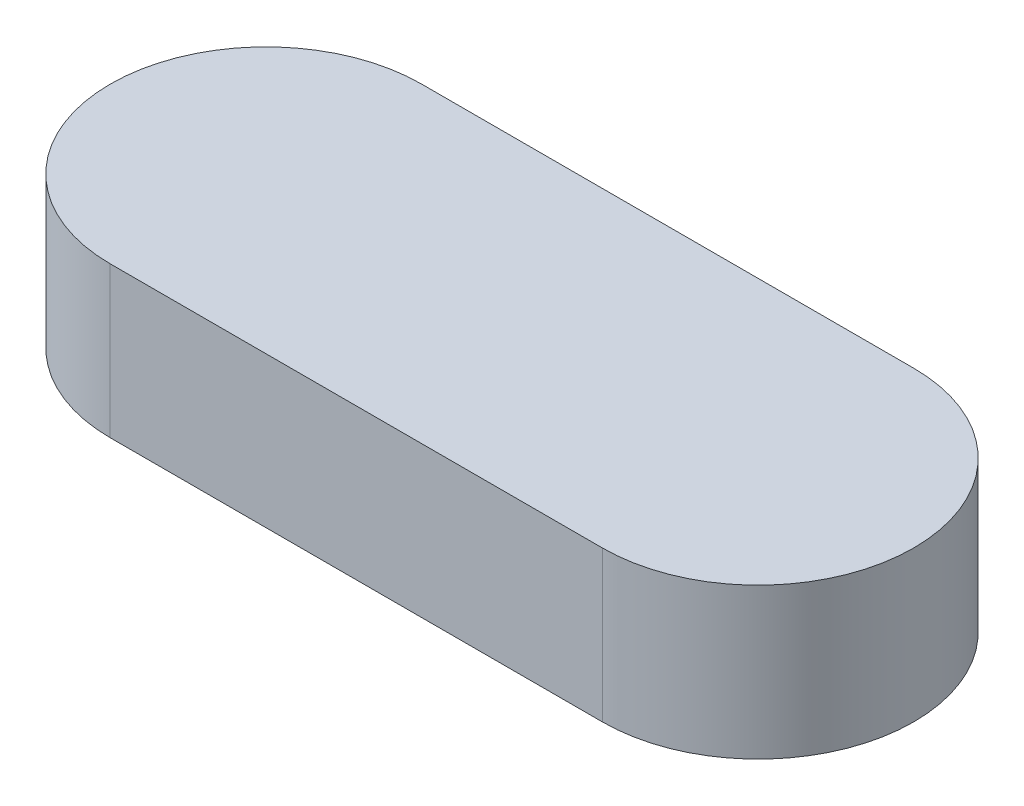
from build123d import *

# Parameters (mm, degrees)
BOSS_EXTRUDE1_DEPTH = 7.5


with BuildPart() as part:
    # Sketch2 → Boss-Extrude1 (new body)
    with BuildSketch(Plane(origin=(0, 0, 0), x_dir=(1, 0, 0), z_dir=(0, 1, 0))):
        with BuildLine():
            Line((-12.25, 7.75), (12.25, 7.75))
            ThreePointArc((12.25, 7.75), (20, 0), (12.25, -7.75))
            Line((12.25, -7.75), (-12.25, -7.75))
            ThreePointArc((-12.25, -7.75), (-20, 0), (-12.25, 7.75))
        make_face()
    extrude(amount=BOSS_EXTRUDE1_DEPTH)


solid = part.part
